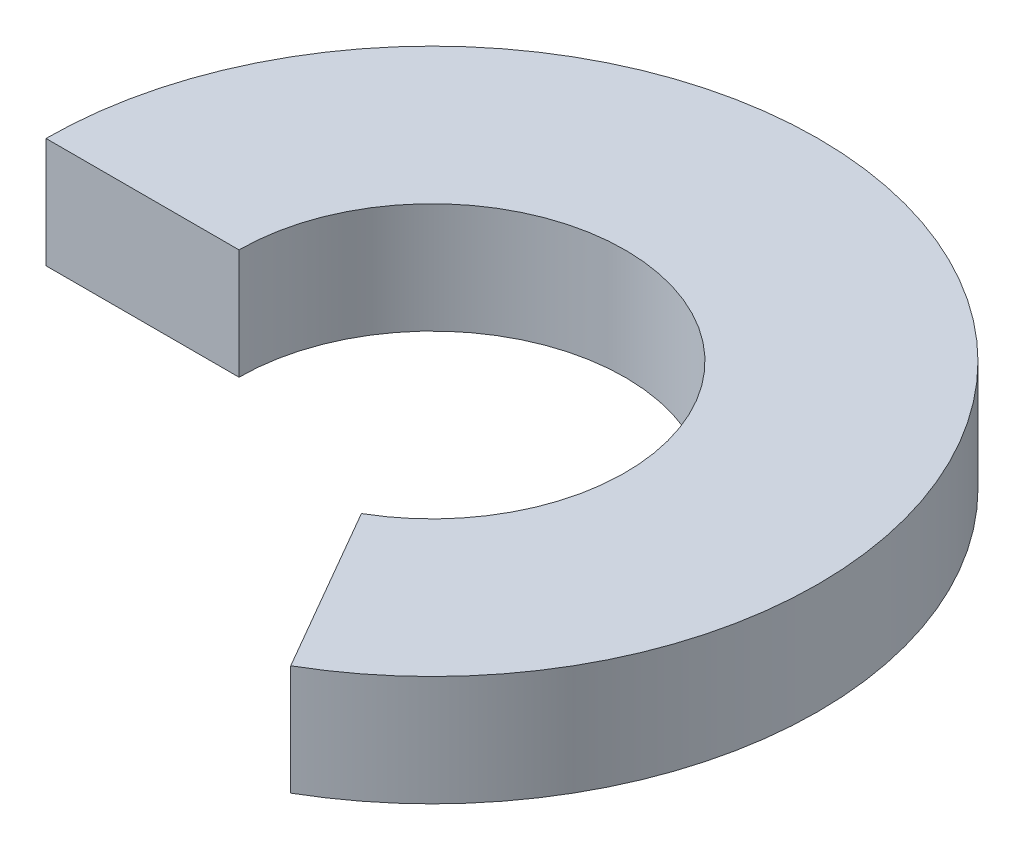
from build123d import *

# Parameters (mm, degrees)
BOSS_EXTRUDE1_DEPTH = 2


with BuildPart() as part:
    # Sketch1 → Boss-Extrude1 (new body)
    with BuildSketch(Plane(origin=(0, 0, 0), x_dir=(1, 0, 0), z_dir=(0, 1, 0))):
        with BuildLine():
            Line((-7, 0), (-3.5, 0))
            ThreePointArc((-3.5, 0), (1.75, 3.031088913), (1.75, -3.031088913))
            Line((1.75, -3.031088913), (3.5, -6.062177826))
            ThreePointArc((3.5, -6.062177826), (3.5, 6.062177826), (-7, 0))
        make_face()
    extrude(amount=BOSS_EXTRUDE1_DEPTH)


solid = part.part
